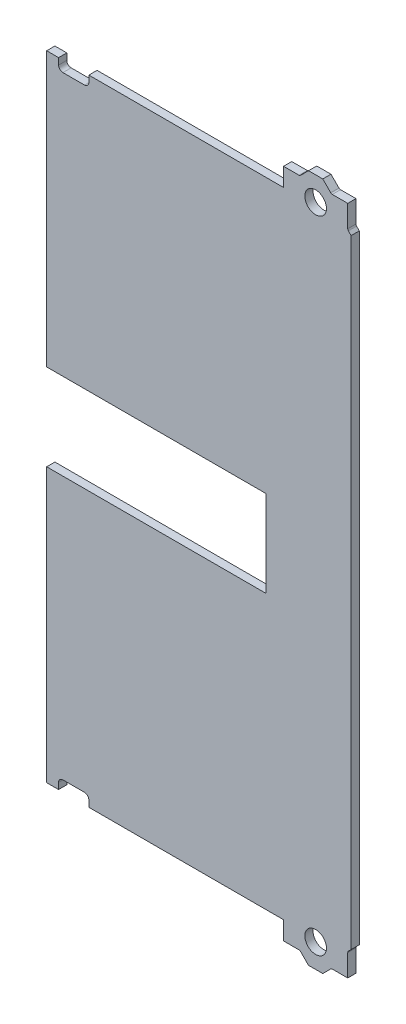
from build123d import *

# Parameters (mm, degrees)
SKETCH1_R           = 5
BOSS_EXTRUDE1_DEPTH = 3.8


with BuildPart() as part:
    # Sketch1 → Boss-Extrude1 (new body)
    with BuildSketch(Plane.XY):
        with BuildLine():
            Line((-124.434769571, -238.739800618), (-118.934676066, -238.739800618))
            Line((-118.934676066, -238.739800618), (-118.934676066, -235.848726439))
            ThreePointArc((-118.934676066, -235.848726439), (-118.348889629, -234.434512877), (-116.934676066, -233.848726439))
            Line((-116.934676066, -233.848726439), (-106.934769571, -233.848726439))
            ThreePointArc((-106.934769571, -233.848726439), (-105.520556009, -234.434512877), (-104.934769571, -235.848726439))
            Line((-104.934769571, -235.848726439), (-104.934769571, -238.848726439))
            Line((-104.934769571, -238.848726439), (-14.85, -238.848726439))
            Line((-14.85, -238.848726439), (-14.85, -247.348726439))
            Line((-14.85, -247.348726439), (-7.707106781, -247.348726439))
            ThreePointArc((-7.707106781, -247.348726439), (-7.324423349, -247.424846907), (-7, -247.641619658))
            Line((-7, -247.641619658), (-3.292893219, -251.348726439))
            Line((-3.292893219, -251.348726439), (3.292893219, -251.348726439))
            Line((3.292893219, -251.348726439), (7, -247.641619658))
            ThreePointArc((7, -247.641619658), (7.324423349, -247.424846907), (7.707106781, -247.348726439))
            Line((7.707106781, -247.348726439), (14.85, -247.348726439))
            Line((14.85, -247.348726439), (14.85, -237.15583322))
            ThreePointArc((14.85, -237.15583322), (14.926120467, -236.773149788), (15.142893219, -236.448726439))
            Line((15.142893219, -236.448726439), (16.4, -235.191619658))
            Line((16.4, -235.191619658), (16.4, 50.89416678))
            Line((16.4, 50.89416678), (15.142893219, 52.151273561))
            ThreePointArc((15.142893219, 52.151273561), (14.926120467, 52.47569691), (14.85, 52.858380342))
            Line((14.85, 52.858380342), (14.85, 63.051273561))
            Line((14.85, 63.051273561), (7.707106781, 63.051273561))
            ThreePointArc((7.707106781, 63.051273561), (7.324423349, 63.127394028), (7, 63.34416678))
            Line((7, 63.34416678), (3.292893219, 67.051273561))
            Line((3.292893219, 67.051273561), (-3.292893219, 67.051273561))
            Line((-3.292893219, 67.051273561), (-7, 63.34416678))
            ThreePointArc((-7, 63.34416678), (-7.324423349, 63.127394028), (-7.707106781, 63.051273561))
            Line((-7.707106781, 63.051273561), (-14.85, 63.051273561))
            Line((-14.85, 63.051273561), (-14.85, 54.551273561))
            Line((-14.85, 54.551273561), (-104.934769571, 54.551273561))
            Line((-104.934769571, 54.551273561), (-104.934769571, 51.551273561))
            ThreePointArc((-104.934769571, 51.551273561), (-105.520556009, 50.137059998), (-106.934769571, 49.551273561))
            Line((-106.934769571, 49.551273561), (-116.934769571, 49.551273561))
            ThreePointArc((-116.934769571, 49.551273561), (-118.348983134, 50.137059998), (-118.934769571, 51.551273561))
            Line((-118.934769571, 51.551273561), (-118.934769571, 54.551273561))
            Line((-118.934769571, 54.551273561), (-124.434769571, 54.551273561))
            Line((-124.434769571, 54.551273561), (-124.434769571, -72.148726439))
            Line((-124.434769571, -72.148726439), (-22.877938229, -72.148726439))
            Line((-22.877938229, -72.148726439), (-22.877938229, -112.148726439))
            Line((-22.877938229, -112.148726439), (-124.434769571, -112.148726439))
            Line((-124.434769571, -112.148726439), (-124.434769571, -238.739800618))
        make_face()
        with Locations(Location((0, -240.335275852, 0), (0, 0, 180))):
            Circle(SKETCH1_R, mode=Mode.SUBTRACT)
        with Locations(Location((0, 56.037822974, 0), (0, 0, 180))):
            Circle(SKETCH1_R, mode=Mode.SUBTRACT)
    extrude(amount=BOSS_EXTRUDE1_DEPTH)


solid = part.part
